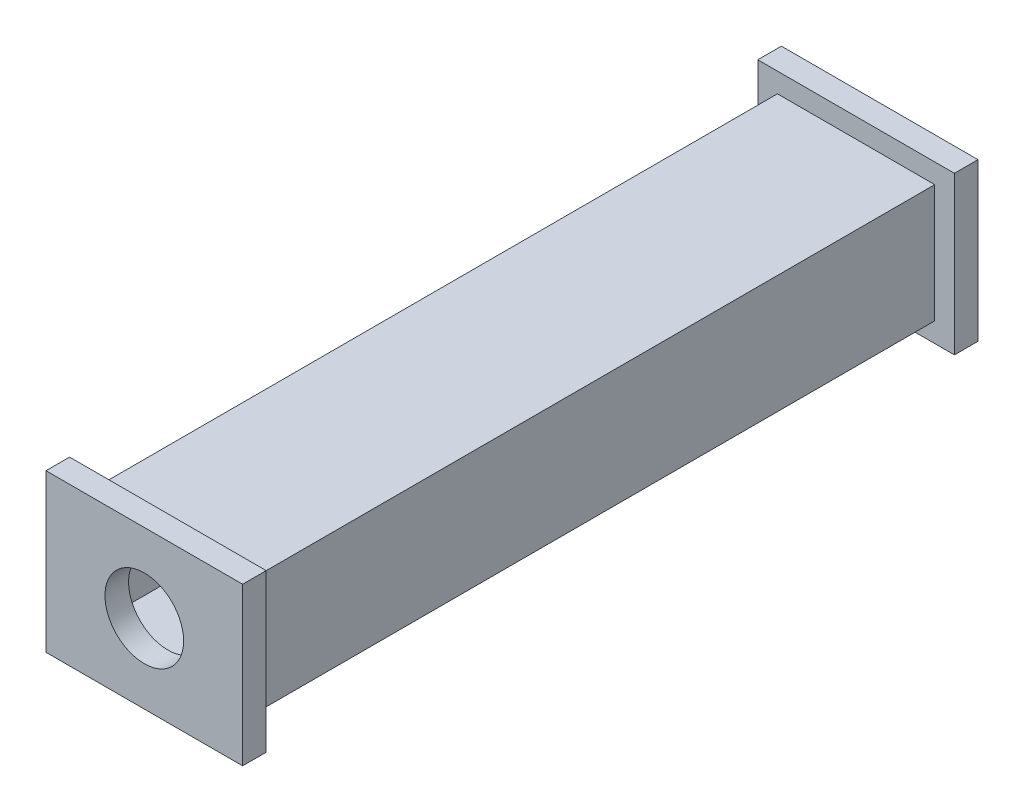
from build123d import *

# Parameters (mm, degrees)
SKETCH_8_W      = 80
SKETCH_8_H      = 60
SKETCH_8_W_2    = 68
SKETCH_8_H_2    = 48
EXTRUDE_1_DEPTH = 175
SKETCH_9_W      = 100
SKETCH_9_H      = 80
SKETCH_9_R      = 20
EXTRUDE_2_DEPTH = 12
EXTRUDE_START   = 12
SKETCH_10_W     = 100
SKETCH_10_H     = 80
SKETCH_10_R     = 20
EXTRUDE_3_DEPTH = 12


with BuildPart() as part:
    # 草图8 → 凸台-拉伸1 (new, symmetric)
    with BuildSketch(Plane.XY):
        Rectangle(SKETCH_8_W, SKETCH_8_H)
        Rectangle(SKETCH_8_W_2, SKETCH_8_H_2, mode=Mode.SUBTRACT)
    extrude(amount=EXTRUDE_1_DEPTH, both=True)

    # 草图9 → 凸台-拉伸2 (add)
    with BuildSketch(Plane.XY.offset(175)):
        Rectangle(SKETCH_9_W, SKETCH_9_H)
        Circle(SKETCH_9_R, mode=Mode.SUBTRACT)
    extrude(amount=EXTRUDE_2_DEPTH)

    # 草图10 → 凸台-拉伸3 (add)
    with BuildSketch(Plane(origin=(0, 0, -175), x_dir=(-1, 0, 0), z_dir=(0, 0, -1)).offset(EXTRUDE_START)):
        Rectangle(SKETCH_10_W, SKETCH_10_H)
        with Locations(Location((0, 0, 0), (0, 0, 180))):
            Circle(SKETCH_10_R, mode=Mode.SUBTRACT)
    extrude(amount=-EXTRUDE_3_DEPTH)


solid = part.part
